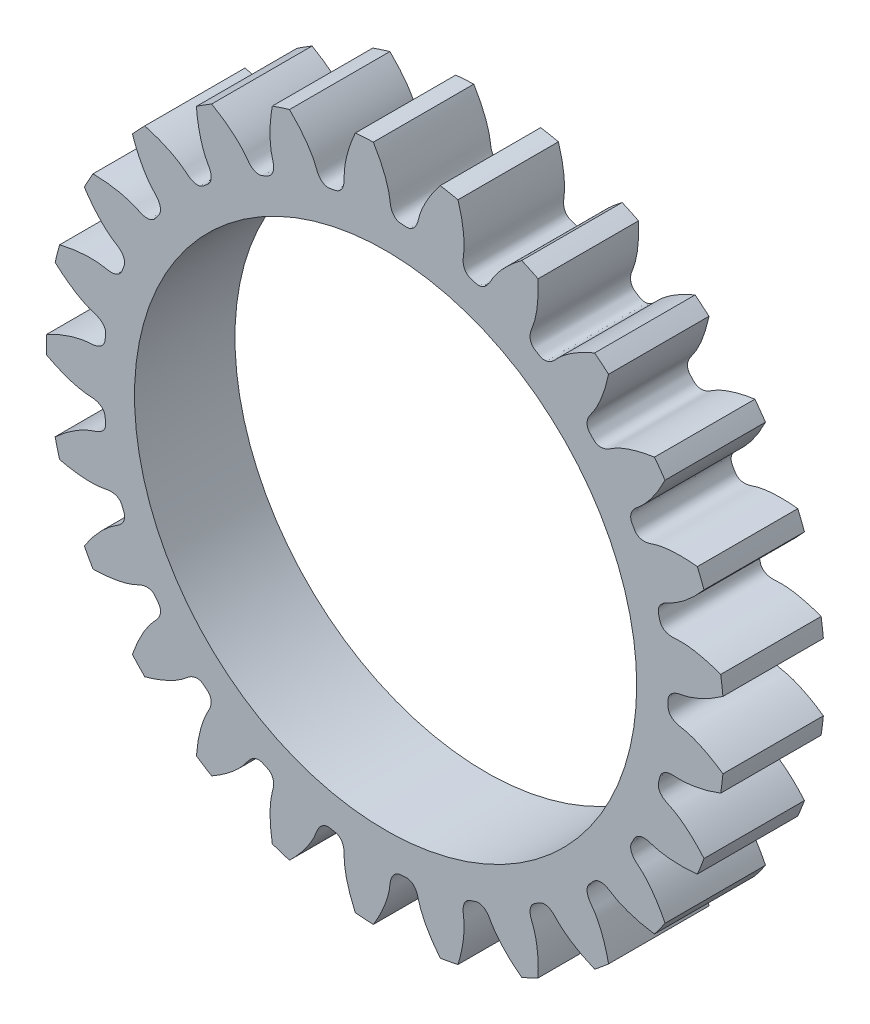
from build123d import *

# Parameters (mm, degrees)
SKETCHREVOLVESPURGEAR_W       = 4
SKETCHREVOLVESPURGEAR_H       = 13.499999797
TOOTHEXTRUDECUTSPURGEAR_DEPTH = 2
PATTERNSPURGEAR_COUNT         = 25
BOREREVOLVESKETCH_W           = 4
BOREREVOLVESKETCH_H           = 10


with BuildPart() as part:
    # SketchRevolveSpurGear → SpurGear (revolve)
    with BuildSketch(Plane(origin=(0, 0, 0), x_dir=(0, 0, -1), z_dir=(1, 0, 0)), mode=Mode.PRIVATE) as spurgear_sk:
        with Locations((0, 6.749999899)):
            Rectangle(SKETCHREVOLVESPURGEAR_W, SKETCHREVOLVESPURGEAR_H)
    revolve(spurgear_sk.sketch.rotate(Axis((0, 0, 0), (0, 0, -1)), 90), axis=Axis((0, 0, 0), (0, 0, -1)))

    # SketchToothSpurGear → ToothExtrudeCutSpurGear (cut, symmetric)
    with BuildSketch(Plane.XY):
        with BuildLine():
            ThreePointArc((13.48079108, 1.367759604), (13.549999796, 0), (13.48079108, -1.367759604))
            add(Edge.make_bspline(
                [(13.48079108, -1.367759604), (13.380886834, -1.295987874), (13.232111933, -1.195117759), (13.033570765, -1.072970681), (12.894717782, -0.992950623), (12.762174891, -0.921557624), (12.636316285, -0.85835904), (12.517496388, -0.802907872), (12.406049342, -0.75474374), (12.302288567, -0.713393758), (12.20650621, -0.678372927), (12.118973088, -0.649186384), (12.039937172, -0.625325697), (11.969626801, -0.60628406), (11.908239368, -0.591512943), (11.799361551, -0.568687216), (11.691684335, -0.553914245), (11.589099942, -0.520212032), (11.539861695, -0.500727816), (11.492227702, -0.477683361), (11.445783157, -0.450190162), (11.400255173, -0.416738633), (11.355834612, -0.37518973), (11.313911201, -0.322840458), (11.277847478, -0.257347808), (11.255667922, -0.183755112), (11.24675293, -0.096245993), (11.251950461, 0), (11.24675293, 0.096245993), (11.255667922, 0.183755112), (11.277847478, 0.257347808), (11.313911201, 0.322840458), (11.355834612, 0.37518973), (11.400255173, 0.416738633), (11.445783157, 0.450190162), (11.492227702, 0.477683361), (11.539861695, 0.500727816), (11.589099942, 0.520212032), (11.691684335, 0.553914245), (11.799361551, 0.568687216), (11.908239368, 0.591512943), (11.969626801, 0.60628406), (12.039937172, 0.625325697), (12.118973088, 0.649186384), (12.20650621, 0.678372927), (12.302288567, 0.713393758), (12.406049342, 0.75474374), (12.517496388, 0.802907872), (12.636316285, 0.85835904), (12.762174891, 0.921557624), (12.894717782, 0.992950623), (13.033570765, 1.072970681), (13.232111933, 1.195117759), (13.380886834, 1.295987874), (13.48079108, 1.367759604)],
                knots=[0, 0, 0, 0, 0.066628363, 0.097312478, 0.126243214, 0.153420573, 0.178844554, 0.202515157, 0.224432382, 0.244596229, 0.263006698, 0.279663789, 0.294567502, 0.307717838, 0.319114795, 0.328758375, 0.367985616, 0.377666442, 0.387173495, 0.396651881, 0.406296908, 0.416367886, 0.427194119, 0.439149378, 0.452549791, 0.467442003, 0.480440239, 0.5, 0.519559761, 0.532557997, 0.547450209, 0.560850622, 0.572805881, 0.583632114, 0.593703092, 0.603348119, 0.612826505, 0.622333558, 0.632014384, 0.671241625, 0.680885205, 0.692282162, 0.705432498, 0.720336211, 0.736993302, 0.755403771, 0.775567618, 0.797484843, 0.821155446, 0.846579427, 0.873756786, 0.902687522, 0.933371637, 1, 1, 1, 1], degree=3))
        make_face()
    toothextrudecutspurgear = extrude(amount=TOOTHEXTRUDECUTSPURGEAR_DEPTH, both=True, mode=Mode.SUBTRACT)

    # PatternSpurGear: ToothExtrudeCutSpurGear ×25 about axis
    patternspurgear_axis = Axis((0, 0, 55), (0, 0, -1))
    for i in range(1, PATTERNSPURGEAR_COUNT):
        add(toothextrudecutspurgear.rotate(patternspurgear_axis, i * 360 / PATTERNSPURGEAR_COUNT), mode=Mode.SUBTRACT)

    # BoreRevolveSketch → BoreRevolveCut (revolve, cut)
    with BuildSketch(Plane(origin=(0, 0, 0), x_dir=(0, 0, -1), z_dir=(1, 0, 0)), mode=Mode.PRIVATE) as borerevolvecut_sk:
        with Locations((0, 5)):
            Rectangle(BOREREVOLVESKETCH_W, BOREREVOLVESKETCH_H)
    revolve(borerevolvecut_sk.sketch.rotate(Axis((0, 0, 0), (0, 0, -1)), 90), axis=Axis((0, 0, 0), (0, 0, -1)), mode=Mode.SUBTRACT)


solid = part.part
